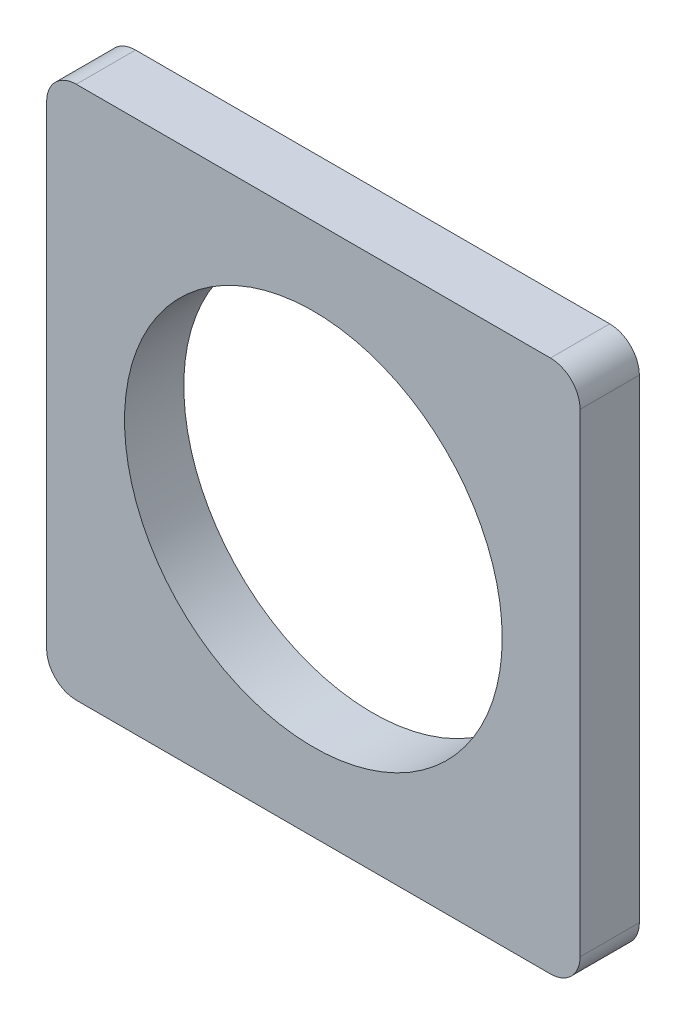
from build123d import *

# Parameters (mm, degrees)
SKETCH1_W           = 57.15
SKETCH1_H           = 57.15
SKETCH1_R           = 20.2311
BOSS_EXTRUDE1_DEPTH = 6.35
FILLET1_R           = 3.175


with BuildPart() as part:
    # Sketch1 → Boss-Extrude1 (new body)
    with BuildSketch(Plane.XY):
        with Locations((107.857474429, 1.282311101)):
            Rectangle(SKETCH1_W, SKETCH1_H)
        with Locations((107.857474429, 1.282311101)):
            Circle(SKETCH1_R, mode=Mode.SUBTRACT)
    extrude(amount=BOSS_EXTRUDE1_DEPTH)

    # Fillet1
    fillet1_edges = [part.edges().sort_by_distance(p)[0] for p in [
        (136.432474429, -27.292688899, 3.175),
        (79.282474429, -27.292688899, 3.175),
        (79.282474429, 29.857311101, 3.175),
        (136.432474429, 29.857311101, 3.175),
    ]]
    fillet(fillet1_edges, radius=FILLET1_R)


solid = part.part
